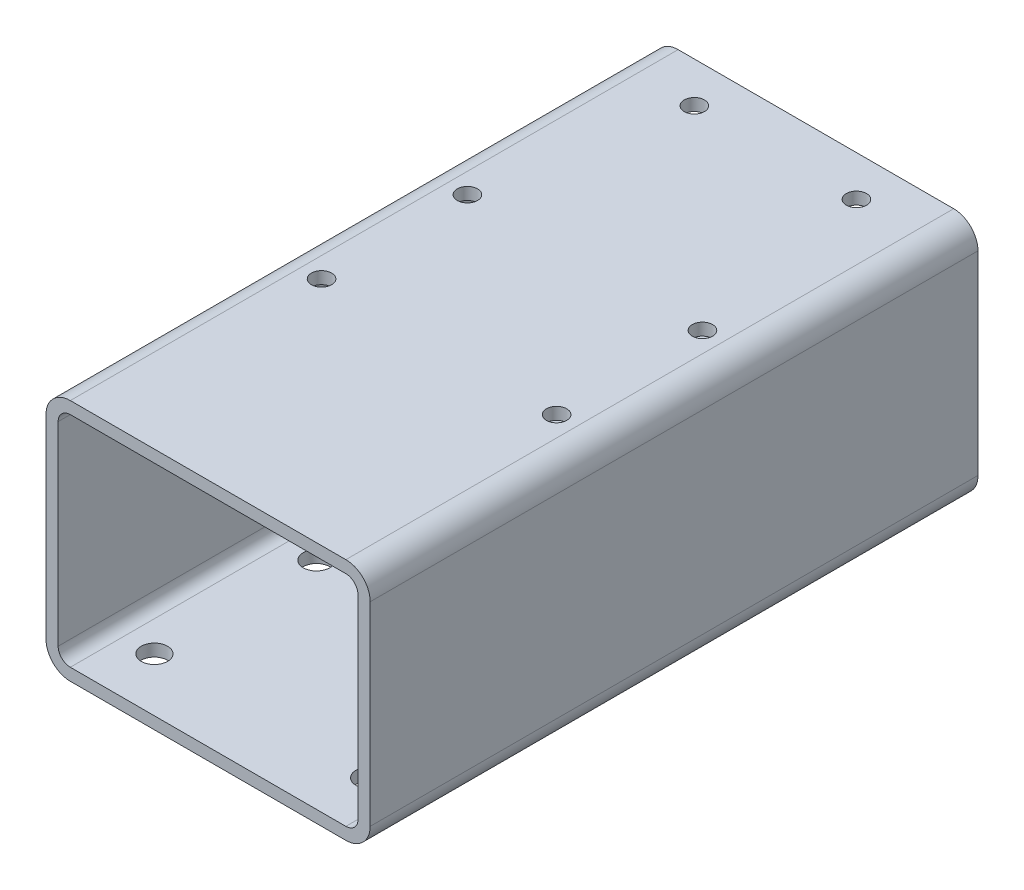
from build123d import *

# Parameters (mm, degrees)
BOSS_EXTRUDE1_DEPTH             = 75
BOSS_EXTRUDE1_DEPTH_BACK        = 75
F_6_5_6_5_DIAMETER_HOLE1_D      = 6.5
F_6_5_6_5_DIAMETER_HOLE1_DEPTH  = 3
TAP_DRILL_FOR_M6X1_0_TAP1_D     = 5
TAP_DRILL_FOR_M6X1_0_TAP1_DEPTH = 3


with BuildPart() as part:
    # Sketch1 → Boss-Extrude1 (new, two sides: drawn at the far end of the back side and taken through both)
    with BuildSketch(Plane.XY.offset(-BOSS_EXTRUDE1_DEPTH_BACK)):
        with BuildLine():
            Line((-34, -30), (34, -30))
            ThreePointArc((34, -30), (38.242640687, -28.242640687), (40, -24))
            Line((40, -24), (40, 24))
            ThreePointArc((40, 24), (38.242640687, 28.242640687), (34, 30))
            Line((34, 30), (-34, 30))
            ThreePointArc((-34, 30), (-38.242640687, 28.242640687), (-40, 24))
            Line((-40, 24), (-40, -24))
            ThreePointArc((-40, -24), (-38.242640687, -28.242640687), (-34, -30))
        make_face()
        with BuildLine():
            Line((-34, 27), (34, 27))
            ThreePointArc((34, 27), (36.121320344, 26.121320344), (37, 24))
            Line((37, 24), (37, -24))
            ThreePointArc((37, -24), (36.121320344, -26.121320344), (34, -27))
            Line((34, -27), (-34, -27))
            ThreePointArc((-34, -27), (-36.121320344, -26.121320344), (-37, -24))
            Line((-37, -24), (-37, 24))
            ThreePointArc((-37, 24), (-36.121320344, 26.121320344), (-34, 27))
        make_face(mode=Mode.SUBTRACT)
    extrude(amount=BOSS_EXTRUDE1_DEPTH + BOSS_EXTRUDE1_DEPTH_BACK)

    # Ø6.5 (6.5) Diameter Hole1
    with Locations(Plane(origin=(-26.5, -30, 61.75), x_dir=(0, 0, -1), z_dir=(0, -1, 0))):
        with Locations((0, 0), (0, 53), (40, 53), (40, 0), (83.5, 0), (83.5, 53), (123.5, 53), (123.5, 0)):
            Hole(F_6_5_6_5_DIAMETER_HOLE1_D / 2, depth=F_6_5_6_5_DIAMETER_HOLE1_DEPTH)

    # Tap Drill for M6x1.0 Tap1
    with Locations(Plane(origin=(29.000000001, 30, -18), x_dir=(1, 0, 0), z_dir=(0, 1, 0))):
        with Locations((0, 0), (0, -36), (-58, -36), (-58, 0), (-49, 47), (-9, 47)):
            Hole(TAP_DRILL_FOR_M6X1_0_TAP1_D / 2, depth=TAP_DRILL_FOR_M6X1_0_TAP1_DEPTH)


solid = part.part
